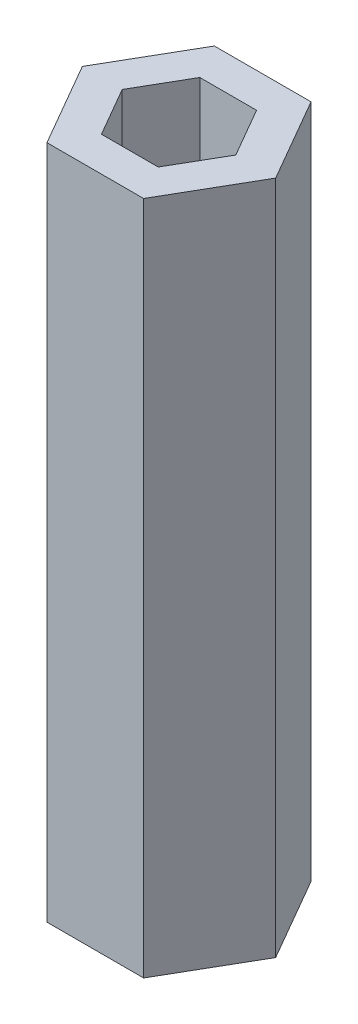
from build123d import *

# Parameters (mm, degrees)
BOSS_EXTRUDE1_DEPTH = 50.8


with BuildPart() as part:
    # Sketch1 → Boss-Extrude1 (new body)
    with BuildSketch(Plane(origin=(0, 0, 0), x_dir=(1, 0, 0), z_dir=(0, 1, 0))):
        Polygon((-3.637306696, 6.3), (-7.274613392, 0), (-3.637306696, -6.3), (3.637306696, -6.3), (7.274613392, 0), (3.637306696, 6.3), align=None)
        Polygon((2.136195996, 3.7), (-2.136195996, 3.7), (-4.272391992, 0), (-2.136195996, -3.7), (2.136195996, -3.7), (4.272391992, 0), align=None, mode=Mode.SUBTRACT)
    extrude(amount=BOSS_EXTRUDE1_DEPTH)


solid = part.part
